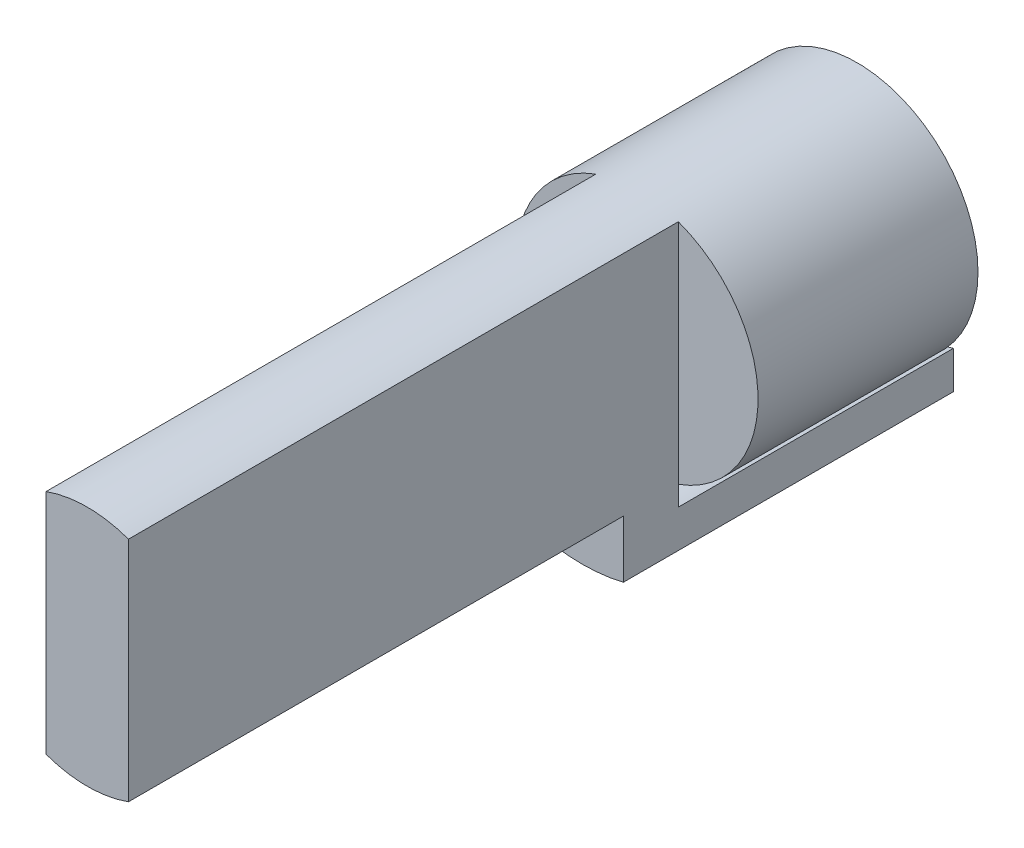
from build123d import *
from build123d.topology import SkipClean

# Parameters (mm, degrees)
SKETCH2_R               = 11
BOSS_EXTRUDE1_DEPTH     = 20
BOSS_EXTRUDE2_DEPTH     = 50
BOSS_EXTRUDE3_START     = -50
BOSS_EXTRUDE3_DEPTH     = 5
CUT_EXTRUDE2_DEPTH      = 72.992538676
CUT_EXTRUDE2_DEPTH_BACK = 72.992538676
SKETCH5_R               = 16.440704867
SKETCH5_R_2             = 12.7
BOSS_EXTRUDE4_START     = -5
BOSS_EXTRUDE4_DEPTH     = 30
CUT_EXTRUDE3_START      = 5
SKETCH7_W               = 3.75
SKETCH7_H               = 16.575715954
CUT_EXTRUDE3_DEPTH      = 25


with BuildPart() as part:
    # Sketch2 → Boss-Extrude1 (new body)
    with BuildSketch(Plane.XY):
        Circle(SKETCH2_R)
    extrude(amount=BOSS_EXTRUDE1_DEPTH)

    # Sketch3 → Boss-Extrude2 (add)
    with SkipClean():  # the faces are left unmerged after this step: merging them gives an invalid solid
        with BuildSketch(Plane.XY.offset(20)):
            with BuildLine():
                Line((3.75, 10.34105894), (3.75, -10.34105894))
                ThreePointArc((3.75, -10.34105894), (0, -11), (-3.75, -10.34105894))
                Line((-3.75, -10.34105894), (-3.75, 10.34105894))
                ThreePointArc((-3.75, 10.34105894), (0, 11), (3.75, 10.34105894))
            make_face()
        extrude(amount=BOSS_EXTRUDE2_DEPTH)

    # Sketch4 → Boss-Extrude3 (add)
    with SkipClean():  # the faces are left unmerged after this step: merging them gives an invalid solid
        with BuildSketch(Plane.XY.offset(70).offset(BOSS_EXTRUDE3_START)):
            with BuildLine():
                Line((-3.75, -10.34105894), (-3.75, -12.159898231))
                ThreePointArc((-3.75, -12.159898231), (0, -12.725), (3.75, -12.159898231))
                Line((3.75, -12.159898231), (3.75, -10.34105894))
                ThreePointArc((3.75, -10.34105894), (0, -11), (-3.75, -10.34105894))
            make_face()
        extrude(amount=BOSS_EXTRUDE3_DEPTH)

    # Sketch5 → Cut-Extrude2 (cut, two sides: drawn at the far end of the back side and taken through both)
    with SkipClean():  # the faces are left unmerged after this step: merging them gives an invalid solid
        with BuildSketch(Plane.XY.offset(70).offset(-CUT_EXTRUDE2_DEPTH_BACK)):
            Circle(SKETCH5_R)
            Circle(SKETCH5_R_2, mode=Mode.SUBTRACT)
        extrude(amount=CUT_EXTRUDE2_DEPTH + CUT_EXTRUDE2_DEPTH_BACK, mode=Mode.SUBTRACT)

    # Sketch6 → Boss-Extrude4 (add)
    with SkipClean():  # the faces are left unmerged after this step: merging them gives an invalid solid
        with BuildSketch(Plane(origin=(0, 0, 20), x_dir=(-1, 0, 0), z_dir=(0, 0, -1)).offset(BOSS_EXTRUDE4_START)):
            with BuildLine():
                Line((-3.75, -12.133733968), (-3.75, -15.55434023))
                ThreePointArc((-3.75, -15.55434023), (0, -16), (3.75, -15.55434023))
                Line((3.75, -15.55434023), (3.75, -12.133733968))
                ThreePointArc((3.75, -12.133733968), (0, -12.7), (-3.75, -12.133733968))
            make_face()
        extrude(amount=BOSS_EXTRUDE4_DEPTH)

    # Sketch7 → Cut-Extrude3 (cut)
    with SkipClean():  # the faces are left unmerged after this step: merging them gives an invalid solid
        with BuildSketch(Plane(origin=(0, 0, 0), x_dir=(-1, 0, 0), z_dir=(0, 0, -1)).offset(CUT_EXTRUDE3_START)):
            with Locations((1.875, -20.421591945)):
                Rectangle(SKETCH7_W, SKETCH7_H)
        extrude(amount=-CUT_EXTRUDE3_DEPTH, mode=Mode.SUBTRACT)


solid = part.part
